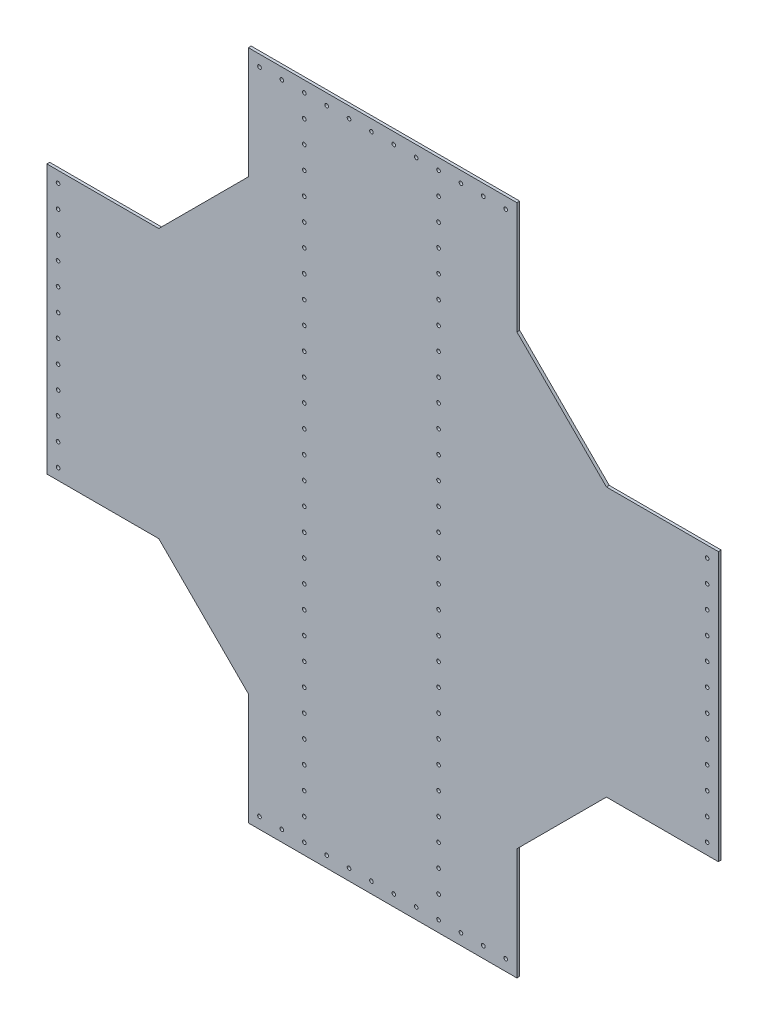
from build123d import *

# Parameters (mm, degrees)
SKETCH1_R           = 2.0701
BOSS_EXTRUDE1_DEPTH = 3.175


with BuildPart() as part:
    # Sketch1 → Boss-Extrude1 (new body)
    with BuildSketch(Plane.XY):
        Polygon((317.5, 546.1), (190.5, 546.1), (88.9, 647.7), (88.9, 774.7), (-215.9, 774.7), (-215.9, 647.7), (-317.5, 546.1), (-444.5, 546.1), (-444.5, 241.3), (-317.5, 241.3), (-215.9, 139.7), (-215.9, 12.7), (88.9, 12.7), (88.9, 139.7), (190.5, 241.3), (317.5, 241.3), align=None)
        with Locations((76.2, 762)):
            Circle(SKETCH1_R, mode=Mode.SUBTRACT)
        with Locations((50.8, 762)):
            Circle(SKETCH1_R, mode=Mode.SUBTRACT)
        with Locations((25.4, 762)):
            Circle(SKETCH1_R, mode=Mode.SUBTRACT)
        with Locations((0, 762)):
            Circle(SKETCH1_R, mode=Mode.SUBTRACT)
        with Locations((-25.4, 762)):
            Circle(SKETCH1_R, mode=Mode.SUBTRACT)
        with Locations((-50.8, 762)):
            Circle(SKETCH1_R, mode=Mode.SUBTRACT)
        with Locations((-76.2, 762)):
            Circle(SKETCH1_R, mode=Mode.SUBTRACT)
        with Locations((-101.6, 762)):
            Circle(SKETCH1_R, mode=Mode.SUBTRACT)
        with Locations((-127, 762)):
            Circle(SKETCH1_R, mode=Mode.SUBTRACT)
        with Locations((-152.4, 762)):
            Circle(SKETCH1_R, mode=Mode.SUBTRACT)
        with Locations((-177.8, 762)):
            Circle(SKETCH1_R, mode=Mode.SUBTRACT)
        with Locations((-203.2, 762)):
            Circle(SKETCH1_R, mode=Mode.SUBTRACT)
        with Locations(Location((76.2, 25.4, 0), (0, 0, 180))):
            Circle(SKETCH1_R, mode=Mode.SUBTRACT)
        with Locations(Location((50.8, 25.4, 0), (0, 0, 180))):
            Circle(SKETCH1_R, mode=Mode.SUBTRACT)
        with Locations(Location((-50.8, 25.4, 0), (0, 0, 180))):
            Circle(SKETCH1_R, mode=Mode.SUBTRACT)
        with Locations(Location((-25.4, 25.4, 0), (0, 0, 180))):
            Circle(SKETCH1_R, mode=Mode.SUBTRACT)
        with Locations(Location((0, 25.4, 0), (0, 0, 180))):
            Circle(SKETCH1_R, mode=Mode.SUBTRACT)
        with Locations(Location((25.4, 25.4, 0), (0, 0, 180))):
            Circle(SKETCH1_R, mode=Mode.SUBTRACT)
        with Locations(Location((-76.2, 25.4, 0), (0, 0, 180))):
            Circle(SKETCH1_R, mode=Mode.SUBTRACT)
        with Locations(Location((-101.6, 25.4, 0), (0, 0, 180))):
            Circle(SKETCH1_R, mode=Mode.SUBTRACT)
        with Locations(Location((-127, 25.4, 0), (0, 0, 180))):
            Circle(SKETCH1_R, mode=Mode.SUBTRACT)
        with Locations(Location((-152.4, 25.4, 0), (0, 0, 180))):
            Circle(SKETCH1_R, mode=Mode.SUBTRACT)
        with Locations(Location((-177.8, 25.4, 0), (0, 0, 180))):
            Circle(SKETCH1_R, mode=Mode.SUBTRACT)
        with Locations(Location((-203.2, 25.4, 0), (0, 0, 180))):
            Circle(SKETCH1_R, mode=Mode.SUBTRACT)
        with Locations(Location((-152.4, 50.8, 0), (0, 0, 180))):
            Circle(SKETCH1_R, mode=Mode.SUBTRACT)
        with Locations(Location((-152.4, 76.2, 0), (0, 0, 180))):
            Circle(SKETCH1_R, mode=Mode.SUBTRACT)
        with Locations(Location((-152.4, 101.6, 0), (0, 0, 180))):
            Circle(SKETCH1_R, mode=Mode.SUBTRACT)
        with Locations(Location((-152.4, 127, 0), (0, 0, 180))):
            Circle(SKETCH1_R, mode=Mode.SUBTRACT)
        with Locations(Location((-152.4, 152.4, 0), (0, 0, 180))):
            Circle(SKETCH1_R, mode=Mode.SUBTRACT)
        with Locations(Location((-152.4, 177.8, 0), (0, 0, 180))):
            Circle(SKETCH1_R, mode=Mode.SUBTRACT)
        with Locations(Location((-152.4, 203.2, 0), (0, 0, 180))):
            Circle(SKETCH1_R, mode=Mode.SUBTRACT)
        with Locations(Location((-152.4, 228.6, 0), (0, 0, 180))):
            Circle(SKETCH1_R, mode=Mode.SUBTRACT)
        with Locations(Location((-152.4, 254, 0), (0, 0, 180))):
            Circle(SKETCH1_R, mode=Mode.SUBTRACT)
        with Locations(Location((-152.4, 279.4, 0), (0, 0, 180))):
            Circle(SKETCH1_R, mode=Mode.SUBTRACT)
        with Locations(Location((-152.4, 304.8, 0), (0, 0, 180))):
            Circle(SKETCH1_R, mode=Mode.SUBTRACT)
        with Locations(Location((-152.4, 330.2, 0), (0, 0, 180))):
            Circle(SKETCH1_R, mode=Mode.SUBTRACT)
        with Locations(Location((-152.4, 355.6, 0), (0, 0, 180))):
            Circle(SKETCH1_R, mode=Mode.SUBTRACT)
        with Locations(Location((-152.4, 381, 0), (0, 0, 180))):
            Circle(SKETCH1_R, mode=Mode.SUBTRACT)
        with Locations(Location((-152.4, 406.4, 0), (0, 0, 180))):
            Circle(SKETCH1_R, mode=Mode.SUBTRACT)
        with Locations(Location((-152.4, 431.8, 0), (0, 0, 180))):
            Circle(SKETCH1_R, mode=Mode.SUBTRACT)
        with Locations(Location((-152.4, 457.2, 0), (0, 0, 180))):
            Circle(SKETCH1_R, mode=Mode.SUBTRACT)
        with Locations(Location((-152.4, 482.6, 0), (0, 0, 180))):
            Circle(SKETCH1_R, mode=Mode.SUBTRACT)
        with Locations(Location((-152.4, 508, 0), (0, 0, 180))):
            Circle(SKETCH1_R, mode=Mode.SUBTRACT)
        with Locations(Location((-152.4, 533.4, 0), (0, 0, 180))):
            Circle(SKETCH1_R, mode=Mode.SUBTRACT)
        with Locations(Location((-152.4, 558.8, 0), (0, 0, 180))):
            Circle(SKETCH1_R, mode=Mode.SUBTRACT)
        with Locations(Location((-152.4, 584.2, 0), (0, 0, 180))):
            Circle(SKETCH1_R, mode=Mode.SUBTRACT)
        with Locations(Location((-152.4, 609.6, 0), (0, 0, 180))):
            Circle(SKETCH1_R, mode=Mode.SUBTRACT)
        with Locations(Location((-152.4, 635, 0), (0, 0, 180))):
            Circle(SKETCH1_R, mode=Mode.SUBTRACT)
        with Locations(Location((-152.4, 660.4, 0), (0, 0, 180))):
            Circle(SKETCH1_R, mode=Mode.SUBTRACT)
        with Locations(Location((-152.4, 685.8, 0), (0, 0, 180))):
            Circle(SKETCH1_R, mode=Mode.SUBTRACT)
        with Locations(Location((-152.4, 711.2, 0), (0, 0, 180))):
            Circle(SKETCH1_R, mode=Mode.SUBTRACT)
        with Locations(Location((-152.4, 736.6, 0), (0, 0, 180))):
            Circle(SKETCH1_R, mode=Mode.SUBTRACT)
        with Locations(Location((0, 50.8, 0), (0, 0, 180))):
            Circle(SKETCH1_R, mode=Mode.SUBTRACT)
        with Locations(Location((0, 76.2, 0), (0, 0, 180))):
            Circle(SKETCH1_R, mode=Mode.SUBTRACT)
        with Locations(Location((0, 101.6, 0), (0, 0, 180))):
            Circle(SKETCH1_R, mode=Mode.SUBTRACT)
        with Locations(Location((0, 127, 0), (0, 0, 180))):
            Circle(SKETCH1_R, mode=Mode.SUBTRACT)
        with Locations(Location((0, 152.4, 0), (0, 0, 180))):
            Circle(SKETCH1_R, mode=Mode.SUBTRACT)
        with Locations(Location((0, 177.8, 0), (0, 0, 180))):
            Circle(SKETCH1_R, mode=Mode.SUBTRACT)
        with Locations(Location((0, 203.2, 0), (0, 0, 180))):
            Circle(SKETCH1_R, mode=Mode.SUBTRACT)
        with Locations(Location((0, 228.6, 0), (0, 0, 180))):
            Circle(SKETCH1_R, mode=Mode.SUBTRACT)
        with Locations(Location((0, 254, 0), (0, 0, 180))):
            Circle(SKETCH1_R, mode=Mode.SUBTRACT)
        with Locations(Location((0, 279.4, 0), (0, 0, 180))):
            Circle(SKETCH1_R, mode=Mode.SUBTRACT)
        with Locations(Location((0, 304.8, 0), (0, 0, 180))):
            Circle(SKETCH1_R, mode=Mode.SUBTRACT)
        with Locations(Location((0, 330.2, 0), (0, 0, 180))):
            Circle(SKETCH1_R, mode=Mode.SUBTRACT)
        with Locations(Location((0, 355.6, 0), (0, 0, 180))):
            Circle(SKETCH1_R, mode=Mode.SUBTRACT)
        with Locations(Location((0, 381, 0), (0, 0, 180))):
            Circle(SKETCH1_R, mode=Mode.SUBTRACT)
        with Locations(Location((0, 406.4, 0), (0, 0, 180))):
            Circle(SKETCH1_R, mode=Mode.SUBTRACT)
        with Locations(Location((0, 431.8, 0), (0, 0, 180))):
            Circle(SKETCH1_R, mode=Mode.SUBTRACT)
        with Locations(Location((0, 457.2, 0), (0, 0, 180))):
            Circle(SKETCH1_R, mode=Mode.SUBTRACT)
        with Locations(Location((0, 482.6, 0), (0, 0, 180))):
            Circle(SKETCH1_R, mode=Mode.SUBTRACT)
        with Locations(Location((0, 508, 0), (0, 0, 180))):
            Circle(SKETCH1_R, mode=Mode.SUBTRACT)
        with Locations(Location((0, 533.4, 0), (0, 0, 180))):
            Circle(SKETCH1_R, mode=Mode.SUBTRACT)
        with Locations(Location((0, 558.8, 0), (0, 0, 180))):
            Circle(SKETCH1_R, mode=Mode.SUBTRACT)
        with Locations(Location((0, 584.2, 0), (0, 0, 180))):
            Circle(SKETCH1_R, mode=Mode.SUBTRACT)
        with Locations(Location((0, 609.6, 0), (0, 0, 180))):
            Circle(SKETCH1_R, mode=Mode.SUBTRACT)
        with Locations(Location((0, 635, 0), (0, 0, 180))):
            Circle(SKETCH1_R, mode=Mode.SUBTRACT)
        with Locations(Location((0, 660.4, 0), (0, 0, 180))):
            Circle(SKETCH1_R, mode=Mode.SUBTRACT)
        with Locations(Location((0, 685.8, 0), (0, 0, 180))):
            Circle(SKETCH1_R, mode=Mode.SUBTRACT)
        with Locations(Location((0, 711.2, 0), (0, 0, 180))):
            Circle(SKETCH1_R, mode=Mode.SUBTRACT)
        with Locations(Location((0, 736.6, 0), (0, 0, 180))):
            Circle(SKETCH1_R, mode=Mode.SUBTRACT)
        with Locations((-431.8, 533.4)):
            Circle(SKETCH1_R, mode=Mode.SUBTRACT)
        with Locations((-431.8, 508)):
            Circle(SKETCH1_R, mode=Mode.SUBTRACT)
        with Locations((-431.8, 482.6)):
            Circle(SKETCH1_R, mode=Mode.SUBTRACT)
        with Locations((-431.8, 457.2)):
            Circle(SKETCH1_R, mode=Mode.SUBTRACT)
        with Locations((-431.8, 431.8)):
            Circle(SKETCH1_R, mode=Mode.SUBTRACT)
        with Locations((-431.8, 406.4)):
            Circle(SKETCH1_R, mode=Mode.SUBTRACT)
        with Locations((-431.8, 381)):
            Circle(SKETCH1_R, mode=Mode.SUBTRACT)
        with Locations((-431.8, 355.6)):
            Circle(SKETCH1_R, mode=Mode.SUBTRACT)
        with Locations((-431.8, 330.2)):
            Circle(SKETCH1_R, mode=Mode.SUBTRACT)
        with Locations((-431.8, 304.8)):
            Circle(SKETCH1_R, mode=Mode.SUBTRACT)
        with Locations((-431.8, 279.4)):
            Circle(SKETCH1_R, mode=Mode.SUBTRACT)
        with Locations((-431.8, 254)):
            Circle(SKETCH1_R, mode=Mode.SUBTRACT)
        with Locations(Location((304.8, 254, 0), (0, 0, 180))):
            Circle(SKETCH1_R, mode=Mode.SUBTRACT)
        with Locations(Location((304.8, 279.4, 0), (0, 0, 180))):
            Circle(SKETCH1_R, mode=Mode.SUBTRACT)
        with Locations(Location((304.8, 304.8, 0), (0, 0, 180))):
            Circle(SKETCH1_R, mode=Mode.SUBTRACT)
        with Locations(Location((304.8, 330.2, 0), (0, 0, 180))):
            Circle(SKETCH1_R, mode=Mode.SUBTRACT)
        with Locations(Location((304.8, 355.6, 0), (0, 0, 180))):
            Circle(SKETCH1_R, mode=Mode.SUBTRACT)
        with Locations(Location((304.8, 381, 0), (0, 0, 180))):
            Circle(SKETCH1_R, mode=Mode.SUBTRACT)
        with Locations(Location((304.8, 406.4, 0), (0, 0, 180))):
            Circle(SKETCH1_R, mode=Mode.SUBTRACT)
        with Locations(Location((304.8, 431.8, 0), (0, 0, 180))):
            Circle(SKETCH1_R, mode=Mode.SUBTRACT)
        with Locations(Location((304.8, 457.2, 0), (0, 0, 180))):
            Circle(SKETCH1_R, mode=Mode.SUBTRACT)
        with Locations(Location((304.8, 482.6, 0), (0, 0, 180))):
            Circle(SKETCH1_R, mode=Mode.SUBTRACT)
        with Locations(Location((304.8, 508, 0), (0, 0, 180))):
            Circle(SKETCH1_R, mode=Mode.SUBTRACT)
        with Locations(Location((304.8, 533.4, 0), (0, 0, 180))):
            Circle(SKETCH1_R, mode=Mode.SUBTRACT)
    extrude(amount=BOSS_EXTRUDE1_DEPTH)


solid = part.part
